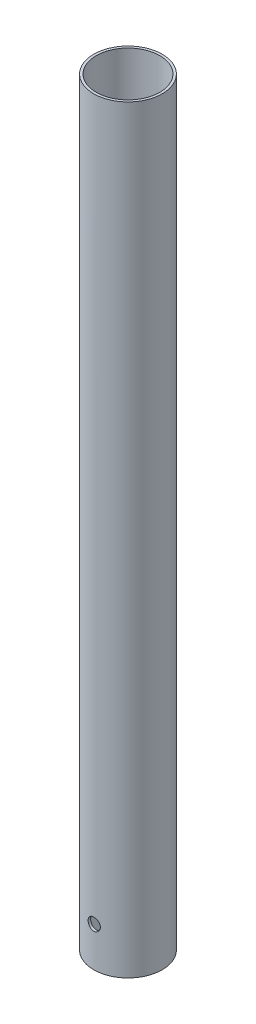
from build123d import *

# Parameters (mm, degrees)
SKETCH_1_R               = 14
SKETCH_1_R_2             = 13
EXTRUDE_1_DEPTH          = 310
CUT_EXTRUDE_1_DEPTH      = 311.631614618
CUT_EXTRUDE_1_DEPTH_BACK = 311.631614618
SKETCH_2_R               = 2.5


with BuildPart() as part:
    # 草图1 → 凸台-拉伸1 (new body)
    with BuildSketch(Plane(origin=(0, 0, 0), x_dir=(1, 0, 0), z_dir=(0, 1, 0))):
        with Locations(Location((0, 0, 0), (0, 0, 270))):
            Circle(SKETCH_1_R)
        with Locations(Location((0, 0, 0), (0, 0, 270))):
            Circle(SKETCH_1_R_2, mode=Mode.SUBTRACT)
    extrude(amount=EXTRUDE_1_DEPTH)

    # 草图2 → 切除-拉伸1 (cut, two sides: drawn at the far end of the back side and taken through both)
    with BuildSketch(Plane.XY.offset(-CUT_EXTRUDE_1_DEPTH_BACK)):
        with Locations((0, 16.17)):
            Circle(SKETCH_2_R)
    extrude(amount=CUT_EXTRUDE_1_DEPTH + CUT_EXTRUDE_1_DEPTH_BACK, mode=Mode.SUBTRACT)


solid = part.part
